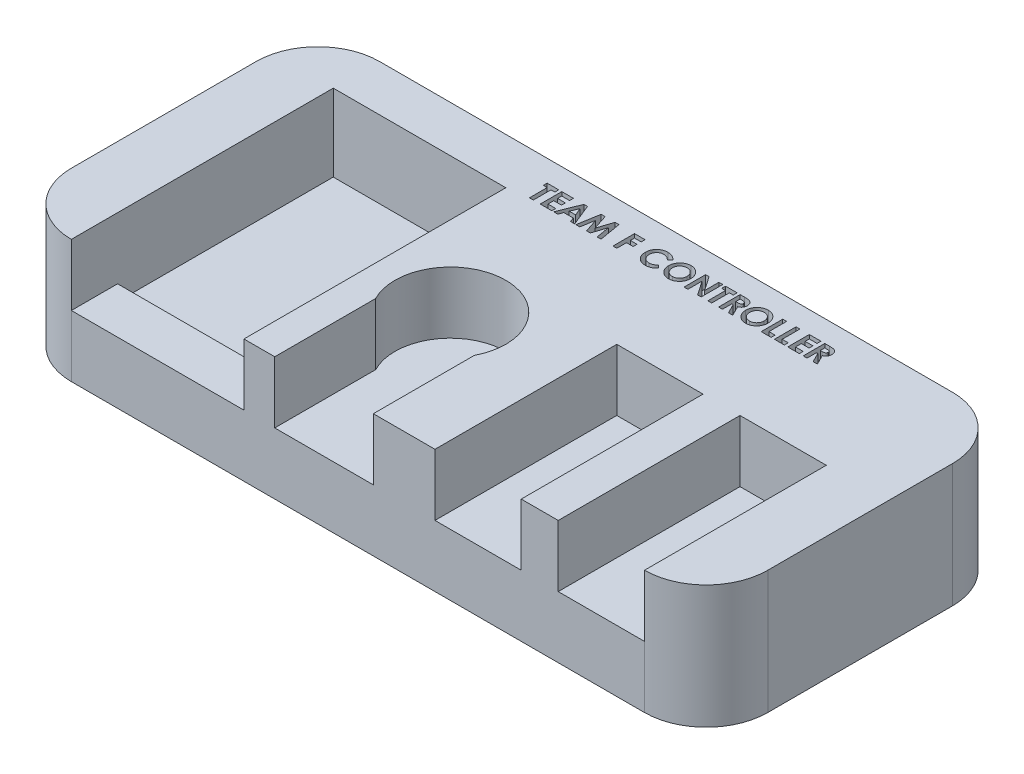
from build123d import *

# Parameters (mm, degrees)
SKETCH1_W           = 113
SKETCH1_H           = 50
BOSS_EXTRUDE1_DEPTH = 20
SKETCH2_W           = 28
SKETCH2_H           = 35
CUT_EXTRUDE2_DEPTH  = 12.5
CUT_EXTRUDE3_DEPTH  = 10
SKETCH4_W           = 14
SKETCH4_H           = 22
CUT_EXTRUDE4_DEPTH  = 10
CUT_EXTRUDE5_DEPTH  = 2
SKETCH6_W           = 14
SKETCH6_H           = 10
SKETCH6_W_2         = 16
SKETCH6_W_3         = 28
CUT_EXTRUDE6_DEPTH  = 10
FILLET1_R           = 10


with BuildPart() as part:
    # Sketch1 → Boss-Extrude1 (new body)
    with BuildSketch(Plane(origin=(0, 0, 0), x_dir=(1, 0, 0), z_dir=(0, 1, 0))):
        Rectangle(SKETCH1_W, SKETCH1_H)
    extrude(amount=BOSS_EXTRUDE1_DEPTH)

    # Sketch2 → Cut-Extrude2 (cut)
    with BuildSketch(Plane(origin=(0, 20, 0), x_dir=(1, 0, 0), z_dir=(0, 1, 0))):
        with Locations((-32.5, 0)):
            Rectangle(SKETCH2_W, SKETCH2_H)
    extrude(amount=-CUT_EXTRUDE2_DEPTH, mode=Mode.SUBTRACT)

    # Sketch3 → Cut-Extrude3 (cut)
    with BuildSketch(Plane(origin=(0, 20, 0), x_dir=(1, 0, 0), z_dir=(0, 1, 0))):
        with BuildLine():
            Line((-13.5, -8.623105626), (-13.5, -17.5))
            Line((-13.5, -17.5), (2.5, -17.5))
            Line((2.5, -17.5), (2.5, -8.623105626))
            ThreePointArc((2.5, -8.623105626), (-5.5, 4.5), (-13.5, -8.623105626))
        make_face()
    extrude(amount=-CUT_EXTRUDE3_DEPTH, mode=Mode.SUBTRACT)

    # Sketch4 → Cut-Extrude4 (cut)
    with BuildSketch(Plane(origin=(0, 20, 0), x_dir=(1, 0, 0), z_dir=(0, 1, 0))):
        with Locations((19.5, -6.5)):
            Rectangle(SKETCH4_W, SKETCH4_H)
        with Locations((39.5, -6.5)):
            Rectangle(SKETCH4_W, SKETCH4_H)
    extrude(amount=-CUT_EXTRUDE4_DEPTH, mode=Mode.SUBTRACT)

    # Sketch5 → Cut-Extrude5 (cut)
    # profile 1 of 15: a face of its own
    with BuildSketch(Plane(origin=(0, 20, 0), x_dir=(1, 0, 0), z_dir=(0, 1, 0))):
        Polygon((-15.798076923, 21.5), (-13.913461538, 21.5), (-13.913461538, 20.871794872), (-14.541666667, 20.871794872), (-14.541666667, 18), (-15.169871795, 18), (-15.169871795, 20.871794872), (-15.798076923, 20.871794872), align=None)
    # profile 2 of 15: a face of its own
    with BuildSketch(Plane(origin=(0, 20, 0), x_dir=(1, 0, 0), z_dir=(0, 1, 0))):
        Polygon((-13.419871795, 21.5), (-11.53525641, 21.5), (-11.53525641, 20.871794872), (-12.791666667, 20.871794872), (-12.791666667, 20.198717949), (-11.53525641, 20.198717949), (-11.53525641, 19.570512821), (-12.791666667, 19.570512821), (-12.791666667, 18.628205128), (-11.53525641, 18.628205128), (-11.53525641, 18), (-13.419871795, 18), align=None)
    # profile 3 of 15: a face of its own
    with BuildSketch(Plane(origin=(0, 20, 0), x_dir=(1, 0, 0), z_dir=(0, 1, 0))):
        Polygon((-9.829427083, 21.5), (-9.246794872, 21.5), (-7.833333333, 18), (-8.504306891, 18), (-8.776342147, 18.717948718), (-10.301282051, 18.717948718), (-10.573317308, 18), (-11.243589744, 18), align=None)
        Polygon((-9.538461538, 20.561197917), (-10.062900641, 19.346153846), (-9.014022436, 19.346153846), align=None, mode=Mode.SUBTRACT)
    # profile 4 of 15: a face of its own
    with BuildSketch(Plane(origin=(0, 20, 0), x_dir=(1, 0, 0), z_dir=(0, 1, 0))):
        Polygon((-7.040364583, 21.5), (-6.388321314, 21.5), (-5.58974359, 19.05869391), (-4.785556891, 21.5), (-4.139823718, 21.5), (-3.548076923, 18), (-4.183994391, 18), (-4.557692308, 20.210637019), (-5.285456731, 18), (-5.898237179, 18), (-6.621794872, 20.210637019), (-6.994791667, 18), (-7.631410256, 18), align=None)
    # profile 5 of 15: a face of its own
    with BuildSketch(Plane(origin=(0, 20, 0), x_dir=(1, 0, 0), z_dir=(0, 1, 0))):
        Polygon((-1.618589744, 21.5), (0.086538462, 21.5), (0.086538462, 20.871794872), (-0.990384615, 20.871794872), (-0.990384615, 20.198717949), (0.086538462, 20.198717949), (0.086538462, 19.570512821), (-0.990384615, 19.570512821), (-0.990384615, 18), (-1.618589744, 18), align=None)
    # profile 6 of 15: a face of its own
    with BuildSketch(Plane(origin=(0, 20, 0), x_dir=(1, 0, 0), z_dir=(0, 1, 0))):
        with BuildLine():
            Line((5.201923077, 20.892828526), (4.741286058, 20.452524038))
            add(Edge.make_bspline(
                [(4.741286058, 20.452524038), (4.702211073, 20.492927638), (4.625885386, 20.571848526), (4.502895981, 20.676332827), (4.374991478, 20.763406355), (4.244660004, 20.836739125), (4.109557273, 20.892220593), (3.97124544, 20.932650872), (3.828841345, 20.957299686), (3.732467731, 20.960119946), (3.683994391, 20.961538462)],
                knots=[0, 0, 0, 0, 1.115251505, 2.178435587, 3.19620269, 4.182487026, 5.141301733, 6.088180966, 7.038406374, 8, 8, 8, 8], degree=3))
            add(Edge.make_bspline(
                [(3.683994391, 20.961538462), (3.643513262, 20.960417785), (3.563628213, 20.958206253), (3.446336028, 20.941993543), (3.334139992, 20.914423124), (3.226656038, 20.876425979), (3.124200445, 20.82725969), (3.0265584, 20.766962311), (2.933970636, 20.696078413), (2.847660184, 20.614974752), (2.768706416, 20.526362907), (2.698945735, 20.431814281), (2.640509974, 20.331545478), (2.592552695, 20.226571947), (2.555195829, 20.116407818), (2.528518333, 20.00112726), (2.513088782, 19.88059298), (2.510785819, 19.798654675), (2.509615385, 19.757011218)],
                knots=[0, 0, 0, 0, 1.035432265, 2.043311493, 3.022114605, 3.98653278, 4.95457646, 5.923598177, 6.917315552, 7.932509744, 8.948865224, 9.949768934, 10.933144597, 11.912367597, 12.897413939, 13.903909035, 14.934704909, 16, 16, 16, 16], degree=3))
            add(Edge.make_bspline(
                [(2.509615385, 19.757011218), (2.50995269, 19.727782926), (2.510617527, 19.670173362), (2.517895338, 19.584952828), (2.52961433, 19.502268764), (2.546574616, 19.422246412), (2.567783619, 19.344816425), (2.59266661, 19.26931082), (2.623881955, 19.196772912), (2.65853146, 19.126360221), (2.698828434, 19.059994047), (2.742276006, 18.996708391), (2.789387805, 18.936813475), (2.840468975, 18.88055415), (2.896238422, 18.828809624), (2.955254711, 18.780023877), (3.018513366, 18.735418182), (3.084700343, 18.69387311), (3.154387415, 18.657782552), (3.22568381, 18.625091479), (3.299670525, 18.598541467), (3.375446727, 18.577139735), (3.452741618, 18.558940759), (3.532311215, 18.54773509), (3.613465749, 18.539249168), (3.668312593, 18.538725212), (3.695913462, 18.538461538)],
                knots=[0, 0, 0, 0, 1.103660481, 2.175337485, 3.227646561, 4.255952547, 5.262355991, 6.258840057, 7.255597736, 8.242457506, 9.22035537, 10.185017736, 11.140346927, 12.096287581, 13.051739095, 14.01125915, 14.986044842, 15.97314143, 16.960198552, 17.947847494, 18.933482797, 19.925264591, 20.920966487, 21.929612487, 22.958107872, 24, 24, 24, 24], degree=3))
            add(Edge.make_bspline(
                [(3.695913462, 18.538461538), (3.742729278, 18.5398157), (3.834710185, 18.542476276), (3.969705391, 18.563281603), (4.098342373, 18.597505189), (4.201122706, 18.637921255), (4.281648382, 18.677832645), (4.342951389, 18.714748715), (4.406343476, 18.756043392), (4.470771755, 18.803275183), (4.536960916, 18.855877287), (4.603742568, 18.915001788), (4.672826333, 18.978701801), (4.718082423, 19.024165752), (4.741286058, 19.047475962)],
                knots=[0, 0, 0, 0, 1.404581149, 2.759636711, 4.088442092, 5.392261763, 6.066678138, 6.783632037, 7.538459478, 8.336747902, 9.180226004, 10.074962426, 11.012997595, 12, 12, 12, 12], degree=3))
            Line((4.741286058, 19.047475962), (5.187900641, 18.578425481))
            add(Edge.make_bspline(
                [(5.187900641, 18.578425481), (5.15650604, 18.548114979), (5.095230492, 18.488955361), (5.002798029, 18.404954225), (4.910481897, 18.329469865), (4.820512259, 18.259762532), (4.731415321, 18.197862968), (4.64320053, 18.143709355), (4.556866516, 18.095932068), (4.470620526, 18.055336849), (4.383925893, 18.020867291), (4.294727304, 17.991191265), (4.20275207, 17.966086414), (4.107438449, 17.945830096), (4.009675467, 17.929587264), (3.908548194, 17.918623446), (3.804697825, 17.911252837), (3.734254512, 17.910590526), (3.698717949, 17.91025641)],
                knots=[0, 0, 0, 0, 1.244526981, 2.429050516, 3.560637417, 4.644440555, 5.67424972, 6.652764056, 7.595344123, 8.486817594, 9.369275933, 10.254498637, 11.166417451, 12.086725134, 13.032340136, 13.991389299, 14.986715468, 16, 16, 16, 16], degree=3))
            add(Edge.make_bspline(
                [(3.698717949, 17.91025641), (3.633441685, 17.911920432), (3.505714181, 17.915176461), (3.318532854, 17.93930143), (3.140715618, 17.979746515), (2.971829878, 18.036947022), (2.811929333, 18.110017988), (2.661054893, 18.199599561), (2.519449733, 18.305453737), (2.388257744, 18.426339803), (2.269588346, 18.559848314), (2.164698341, 18.703199828), (2.077933325, 18.857098866), (2.005890462, 19.019271846), (1.949553891, 19.190458828), (1.909902496, 19.370844982), (1.88544977, 19.560256136), (1.882774607, 19.689628321), (1.881410256, 19.755608974)],
                knots=[0, 0, 0, 0, 1.078019885, 2.10938526, 3.111377082, 4.085535484, 5.04941344, 6.010039228, 6.978205633, 7.964457913, 8.951525778, 9.924444315, 10.892603023, 11.863865945, 12.85144698, 13.863884204, 14.910567087, 16, 16, 16, 16], degree=3))
            add(Edge.make_bspline(
                [(1.881410256, 19.755608974), (1.881986765, 19.798640994), (1.883129264, 19.883919938), (1.895137031, 20.009542733), (1.911876557, 20.132002487), (1.938432293, 20.250027663), (1.970442613, 20.365208277), (2.010251652, 20.476292451), (2.057795829, 20.583599451), (2.111542683, 20.687308917), (2.172345962, 20.78674144), (2.240269899, 20.881042737), (2.313565868, 20.970940799), (2.393995051, 21.055242959), (2.480388707, 21.134689407), (2.573136894, 21.208849608), (2.671681776, 21.278787103), (2.776290079, 21.342698373), (2.884929543, 21.400509514), (2.996229936, 21.451501409), (3.109917809, 21.494118891), (3.225512477, 21.529468521), (3.343502326, 21.555854519), (3.463045176, 21.575827869), (3.585158193, 21.586993099), (3.667146504, 21.588820919), (3.708533654, 21.58974359)],
                knots=[0, 0, 0, 0, 1.071919942, 2.124283339, 3.142214191, 4.149696895, 5.136002878, 6.119640489, 7.086990633, 8.058538607, 9.028339693, 9.988281803, 10.952401235, 11.916291999, 12.888973767, 13.874849856, 14.873389453, 15.898127285, 16.927174885, 17.938320013, 18.946391617, 19.950418109, 20.947802303, 21.956882652, 22.968648068, 24, 24, 24, 24], degree=3))
            add(Edge.make_bspline(
                [(3.708533654, 21.58974359), (3.743841136, 21.589214692), (3.814089001, 21.588162395), (3.91869986, 21.579390354), (4.02247409, 21.565613953), (4.125040148, 21.544828298), (4.227131691, 21.520153099), (4.327407122, 21.487844329), (4.42744834, 21.451830117), (4.525686347, 21.408782479), (4.622258268, 21.361792095), (4.714901755, 21.308479797), (4.805172283, 21.252126365), (4.891069512, 21.189396556), (4.97420248, 21.122565697), (5.05413648, 21.051321984), (5.130170043, 20.974477576), (5.177884485, 20.920182466), (5.201923077, 20.892828526)],
                knots=[0, 0, 0, 0, 0.996412454, 1.982464992, 2.961075852, 3.949442424, 4.934965278, 5.923860011, 6.921385422, 7.934793307, 8.949617135, 9.951082467, 10.950285876, 11.951772932, 12.951063433, 13.960125323, 14.972308753, 16, 16, 16, 16], degree=3))
        make_face()
    # profile 7 of 15: a face of its own
    with BuildSketch(Plane(origin=(0, 20, 0), x_dir=(1, 0, 0), z_dir=(0, 1, 0))):
        with BuildLine():
            add(Edge.make_bspline(
                [(7.474959936, 21.58974359), (7.535811725, 21.588168028), (7.65594694, 21.585057512), (7.83262249, 21.559128935), (8.002882048, 21.516882035), (8.166648626, 21.458155789), (8.323512169, 21.381359592), (8.474025989, 21.288670665), (8.617650952, 21.178339561), (8.752915304, 21.052940123), (8.877923961, 20.91657371), (8.986244036, 20.769751021), (9.078615421, 20.616276382), (9.155173073, 20.455738551), (9.213485974, 20.287025729), (9.254406549, 20.110998126), (9.280695991, 19.927705822), (9.283719681, 19.802908746), (9.28525641, 19.739483173)],
                knots=[0, 0, 0, 0, 1.014329547, 2.002516266, 2.970391464, 3.935626869, 4.897733899, 5.877609409, 6.878433252, 7.912639331, 8.949961323, 9.958554974, 10.949718813, 11.932905612, 12.9188844, 13.919928257, 14.942845884, 16, 16, 16, 16], degree=3))
            add(Edge.make_bspline(
                [(9.28525641, 19.739483173), (9.28361986, 19.67677226), (9.280394986, 19.553198393), (9.255479799, 19.371595199), (9.213870117, 19.197453219), (9.156546248, 19.030378278), (9.081377063, 18.871179629), (8.99080702, 18.718840812), (8.882446148, 18.574775566), (8.760246793, 18.439061204), (8.625715909, 18.315871298), (8.483226346, 18.207310407), (8.333436033, 18.115320004), (8.176564215, 18.039942227), (8.012274488, 17.98144431), (7.840972669, 17.940169778), (7.662669356, 17.915086412), (7.541414457, 17.911882603), (7.479867788, 17.91025641)],
                knots=[0, 0, 0, 0, 1.051557043, 2.072126891, 3.067553643, 4.050577992, 5.02905126, 6.015227836, 7.017913613, 8.04756643, 9.074058332, 10.072836633, 11.047628519, 12.017157415, 12.98668631, 13.966869689, 14.968021931, 16, 16, 16, 16], degree=3))
            add(Edge.make_bspline(
                [(7.479867788, 17.91025641), (7.415497353, 17.911715185), (7.289018247, 17.914581478), (7.103915508, 17.941838618), (6.92657109, 17.982897391), (6.758474788, 18.044175408), (6.597914685, 18.120778081), (6.446070463, 18.215118866), (6.302993152, 18.327041858), (6.169503466, 18.453680666), (6.048561488, 18.592251298), (5.941806469, 18.738638882), (5.851756242, 18.891725147), (5.778407513, 19.051581739), (5.720582322, 19.217215189), (5.679793219, 19.389634252), (5.655698123, 19.568425405), (5.652341816, 19.68986393), (5.650641026, 19.751402244)],
                knots=[0, 0, 0, 0, 1.067978421, 2.098431617, 3.099715153, 4.085208694, 5.062210972, 6.048429807, 7.046490867, 8.072918869, 9.098532598, 10.095778865, 11.076610158, 12.041847152, 13.011192615, 13.984257998, 14.978533688, 16, 16, 16, 16], degree=3))
            add(Edge.make_bspline(
                [(5.650641026, 19.751402244), (5.651174832, 19.792801999), (5.652235684, 19.875077294), (5.665014773, 19.997005082), (5.683412988, 20.116553003), (5.710623073, 20.233244418), (5.743676373, 20.34790253), (5.786501592, 20.459460075), (5.83524828, 20.569108792), (5.892204196, 20.675553593), (5.955533667, 20.777815097), (6.024631759, 20.87541092), (6.099672217, 20.967160983), (6.180413311, 21.053668232), (6.267133286, 21.134364048), (6.358691431, 21.210390793), (6.45686344, 21.279728925), (6.559500636, 21.34407182), (6.666024374, 21.402255985), (6.776001006, 21.451780605), (6.887164796, 21.495029613), (7.001000742, 21.529163642), (7.11628889, 21.556965452), (7.234260859, 21.575351265), (7.353850841, 21.588130001), (7.434494432, 21.58920445), (7.474959936, 21.58974359)],
                knots=[0, 0, 0, 0, 1.034744296, 2.056386356, 3.06226378, 4.057406941, 5.050368692, 6.043467995, 7.042652155, 8.049140477, 9.059438543, 10.048523776, 11.036952808, 12.020949711, 13.004946614, 13.997082645, 14.994316842, 16.007702937, 17.024872941, 18.026463647, 19.021641123, 20.005082605, 20.995858141, 21.984425357, 22.988620895, 24, 24, 24, 24], degree=3))
        make_face()
        with BuildLine():
            add(Edge.make_bspline(
                [(7.465144231, 20.961538462), (7.424190985, 20.960439594), (7.343365664, 20.958270869), (7.224809639, 20.941748119), (7.110991669, 20.91535941), (7.00254269, 20.877135687), (6.898992676, 20.828486588), (6.800158065, 20.7695821), (6.707407512, 20.698397447), (6.619504278, 20.618754215), (6.54009817, 20.530013352), (6.469940369, 20.434912425), (6.41122959, 20.333610251), (6.362058945, 20.227047904), (6.325044347, 20.114027118), (6.298679958, 19.995433197), (6.282018649, 19.871061798), (6.27991847, 19.786277978), (6.278846154, 19.742988782)],
                knots=[0, 0, 0, 0, 1.033739768, 2.040188636, 3.016340934, 3.979330865, 4.937572243, 5.900995986, 6.878200029, 7.884839167, 8.891893314, 9.879764717, 10.863503415, 11.843163062, 12.837761627, 13.859916423, 14.907309254, 16, 16, 16, 16], degree=3))
            add(Edge.make_bspline(
                [(6.278846154, 19.742988782), (6.280267881, 19.695014616), (6.283054231, 19.600993199), (6.302659329, 19.463837288), (6.336201699, 19.334307144), (6.384636229, 19.213036278), (6.444707753, 19.098678068), (6.519307052, 18.992634136), (6.607225971, 18.894269542), (6.674957994, 18.836840195), (6.709334936, 18.807692308)],
                knots=[0, 0, 0, 0, 1.078454662, 2.113592447, 3.107694534, 4.079536787, 5.043276885, 6.005368276, 6.987637804, 8, 8, 8, 8], degree=3))
            add(Edge.make_bspline(
                [(6.709334936, 18.807692308), (6.737496214, 18.786158968), (6.793184293, 18.743577439), (6.882074591, 18.689000474), (6.973614094, 18.642222571), (7.068493584, 18.604426578), (7.166512678, 18.574696886), (7.267657937, 18.553877671), (7.371786045, 18.540811814), (7.442202352, 18.539250196), (7.477764423, 18.538461538)],
                knots=[0, 0, 0, 0, 1.023928204, 2.024787132, 3.009472467, 3.9914905, 4.972207045, 5.96565515, 6.972602802, 8, 8, 8, 8], degree=3))
            add(Edge.make_bspline(
                [(7.477764423, 18.538461538), (7.518013477, 18.539569723), (7.597204757, 18.541750111), (7.713553798, 18.558069457), (7.825019713, 18.585687682), (7.932294491, 18.623576093), (8.035068801, 18.672836023), (8.132840357, 18.733567544), (8.225780577, 18.805024949), (8.313571824, 18.885714071), (8.393817174, 18.974804512), (8.46382857, 19.070412698), (8.524406058, 19.170432093), (8.572554199, 19.276278322), (8.611031161, 19.386952245), (8.63707824, 19.502944012), (8.6538803, 19.623775463), (8.65598107, 19.706005535), (8.657051282, 19.747896635)],
                knots=[0, 0, 0, 0, 1.026359118, 2.019393844, 2.989460624, 3.950973911, 4.916101784, 5.890408035, 6.881132271, 7.902007068, 8.92769091, 9.933912415, 10.920395702, 11.90457117, 12.894218921, 13.903490204, 14.931958862, 16, 16, 16, 16], degree=3))
            add(Edge.make_bspline(
                [(8.657051282, 19.747896635), (8.655944041, 19.789546849), (8.653764606, 19.871528943), (8.637416537, 19.992049736), (8.609973459, 20.107529435), (8.571971273, 20.218156627), (8.523444494, 20.324039771), (8.463436208, 20.424806517), (8.392156978, 20.520359449), (8.311247291, 20.61004741), (8.223182068, 20.692464901), (8.128635253, 20.763988302), (8.03025237, 20.826139863), (7.925776037, 20.874826886), (7.817343752, 20.913615734), (7.704293854, 20.942180399), (7.586198162, 20.958154796), (7.505855221, 20.960400519), (7.465144231, 20.961538462)],
                knots=[0, 0, 0, 0, 1.055025985, 2.07665775, 3.074803781, 4.057872707, 5.035505728, 6.020516407, 7.023567878, 8.050795229, 9.077271434, 10.074415901, 11.050397877, 12.019801805, 12.988065821, 13.964604439, 14.968634123, 16, 16, 16, 16], degree=3))
        make_face(mode=Mode.SUBTRACT)
    # profile 8 of 15: a face of its own
    with BuildSketch(Plane(origin=(0, 20, 0), x_dir=(1, 0, 0), z_dir=(0, 1, 0))):
        Polygon((9.913461538, 21.5), (10.479266827, 21.5), (12.067307692, 19.196814904), (12.067307692, 21.5), (12.695512821, 21.5), (12.695512821, 18), (12.125500801, 18), (10.541666667, 20.296173878), (10.541666667, 18), (9.913461538, 18), align=None)
    # profile 9 of 15: a face of its own
    with BuildSketch(Plane(origin=(0, 20, 0), x_dir=(1, 0, 0), z_dir=(0, 1, 0))):
        Polygon((13.144230769, 21.5), (15.028846154, 21.5), (15.028846154, 20.871794872), (14.400641026, 20.871794872), (14.400641026, 18), (13.772435897, 18), (13.772435897, 20.871794872), (13.144230769, 20.871794872), align=None)
    # profile 10 of 15: a face of its own
    with BuildSketch(Plane(origin=(0, 20, 0), x_dir=(1, 0, 0), z_dir=(0, 1, 0))):
        with BuildLine():
            Line((15.522435897, 21.5), (16.254407051, 21.5))
            add(Edge.make_bspline(
                [(16.254407051, 21.5), (16.302790122, 21.499828268), (16.395844395, 21.499497979), (16.530023575, 21.494286889), (16.653285604, 21.48703523), (16.765812983, 21.475969006), (16.867557571, 21.46129653), (16.95862134, 21.444000109), (17.039001628, 21.42428713), (17.109376332, 21.399723202), (17.172886023, 21.372015463), (17.232085884, 21.340178764), (17.288281953, 21.304567615), (17.341098619, 21.264244991), (17.390994872, 21.219936286), (17.438064844, 21.171596899), (17.481643393, 21.118816932), (17.521460678, 21.061929887), (17.557750929, 21.00208602), (17.589823899, 20.939203166), (17.615905691, 20.873237592), (17.638951751, 20.805142645), (17.655551081, 20.733944894), (17.667095672, 20.660337461), (17.67554817, 20.58406124), (17.676034149, 20.532242562), (17.676282051, 20.505809295)],
                knots=[0, 0, 0, 0, 1.749336639, 3.364467119, 4.854658419, 6.213483162, 7.451590619, 8.570285859, 9.5643256, 10.440900261, 11.26203566, 12.067320669, 12.869050712, 13.665104639, 14.467235401, 15.27997916, 16.102287765, 16.939272006, 17.78853747, 18.631303466, 19.488103222, 20.351255419, 21.228522269, 22.127379805, 23.044756219, 24, 24, 24, 24], degree=3))
            add(Edge.make_bspline(
                [(17.676282051, 20.505809295), (17.675638089, 20.478219036), (17.674375397, 20.424119568), (17.667573848, 20.344651861), (17.655142754, 20.268622717), (17.636314053, 20.196254741), (17.614672908, 20.126647229), (17.585895735, 20.061084482), (17.553417852, 19.998612986), (17.514844819, 19.940116424), (17.472512799, 19.884295469), (17.423281551, 19.833288831), (17.370340503, 19.784355094), (17.310713645, 19.740559303), (17.247029386, 19.698940145), (17.178022386, 19.661222103), (17.104143007, 19.626457035), (17.052202146, 19.607069631), (17.025641026, 19.597155449)],
                knots=[0, 0, 0, 0, 1.099860209, 2.156625411, 3.176576793, 4.16617041, 5.135385252, 6.078461593, 7.016046972, 7.938469504, 8.868247731, 9.803980173, 10.76021508, 11.73834243, 12.748633912, 13.790971185, 14.870363756, 16, 16, 16, 16], degree=3))
            Line((17.025641026, 19.597155449), (17.833333333, 18))
            Line((17.833333333, 18), (17.135016026, 18))
            Line((17.135016026, 18), (16.363782051, 19.525641026))
            Line((16.363782051, 19.525641026), (16.150641026, 19.525641026))
            Line((16.150641026, 19.525641026), (16.150641026, 18))
            Line((16.150641026, 18), (15.522435897, 18))
            Line((15.522435897, 18), (15.522435897, 21.5))
        make_face()
        with BuildLine():
            Line((16.150641026, 20.153846154), (16.395332532, 20.153846154))
            add(Edge.make_bspline(
                [(16.395332532, 20.153846154), (16.425248103, 20.154183083), (16.482529992, 20.15482823), (16.564908873, 20.15782069), (16.639728544, 20.16503104), (16.707310304, 20.174141047), (16.76799422, 20.184659866), (16.821239012, 20.199733972), (16.867865102, 20.215886258), (16.907319968, 20.23595936), (16.941029298, 20.258786831), (16.970135148, 20.284719405), (16.994209859, 20.314733058), (17.014024574, 20.348012147), (17.029438268, 20.384851019), (17.040689084, 20.424845265), (17.046976626, 20.468450472), (17.047700029, 20.498544002), (17.048076923, 20.514222756)],
                knots=[0, 0, 0, 0, 1.688639943, 3.233382647, 4.650958383, 5.928841754, 7.082724185, 8.122798841, 9.049171256, 9.863274652, 10.613301712, 11.341792392, 12.054588806, 12.776240173, 13.521029143, 14.301969904, 15.115324896, 16, 16, 16, 16], degree=3))
            add(Edge.make_bspline(
                [(17.048076923, 20.514222756), (17.047364371, 20.532771868), (17.045964695, 20.569208159), (17.032075557, 20.621663643), (17.009967051, 20.670214782), (16.979662343, 20.71464221), (16.941497504, 20.75359036), (16.897700341, 20.787923465), (16.847325603, 20.815071516), (16.800682388, 20.832978081), (16.758247964, 20.843691763), (16.719952235, 20.851675505), (16.67560555, 20.857333812), (16.625174431, 20.863335453), (16.568787427, 20.867227214), (16.506137195, 20.870067423), (16.437403668, 20.871229493), (16.389489871, 20.871600986), (16.364483173, 20.871794872)],
                knots=[0, 0, 0, 0, 1.020303359, 2.004196876, 2.966617323, 3.9489082, 4.950758222, 5.960522915, 7.003732012, 8.091992268, 8.70421221, 9.413913587, 10.24622431, 11.166358409, 12.212345909, 13.359657661, 14.621978493, 16, 16, 16, 16], degree=3))
            Line((16.364483173, 20.871794872), (16.150641026, 20.871794872))
            Line((16.150641026, 20.871794872), (16.150641026, 20.153846154))
        make_face(mode=Mode.SUBTRACT)
    # profile 11 of 15: a face of its own
    with BuildSketch(Plane(origin=(0, 20, 0), x_dir=(1, 0, 0), z_dir=(0, 1, 0))):
        with BuildLine():
            add(Edge.make_bspline(
                [(19.994190705, 21.58974359), (20.055042495, 21.588168028), (20.17517771, 21.585057512), (20.351853259, 21.559128935), (20.522112817, 21.516882035), (20.685879395, 21.458155789), (20.842742939, 21.381359592), (20.993256758, 21.288670665), (21.136881721, 21.178339561), (21.272146074, 21.052940123), (21.397154731, 20.91657371), (21.505474805, 20.769751021), (21.597846191, 20.616276382), (21.674403842, 20.455738551), (21.732716743, 20.287025729), (21.773637318, 20.110998126), (21.79992676, 19.927705822), (21.80295045, 19.802908746), (21.804487179, 19.739483173)],
                knots=[0, 0, 0, 0, 1.014329547, 2.002516266, 2.970391464, 3.935626869, 4.897733899, 5.877609409, 6.878433252, 7.912639331, 8.949961323, 9.958554974, 10.949718813, 11.932905612, 12.9188844, 13.919928257, 14.942845884, 16, 16, 16, 16], degree=3))
            add(Edge.make_bspline(
                [(21.804487179, 19.739483173), (21.80285063, 19.67677226), (21.799625755, 19.553198393), (21.774710568, 19.371595199), (21.733100886, 19.197453219), (21.675777017, 19.030378278), (21.600607832, 18.871179629), (21.510037789, 18.718840812), (21.401676917, 18.574775566), (21.279477562, 18.439061204), (21.144946678, 18.315871298), (21.002457115, 18.207310407), (20.852666802, 18.115320004), (20.695794984, 18.039942227), (20.531505257, 17.98144431), (20.360203438, 17.940169778), (20.181900125, 17.915086412), (20.060645226, 17.911882603), (19.999098558, 17.91025641)],
                knots=[0, 0, 0, 0, 1.051557043, 2.072126891, 3.067553643, 4.050577992, 5.02905126, 6.015227836, 7.017913613, 8.04756643, 9.074058332, 10.072836633, 11.047628519, 12.017157415, 12.98668631, 13.966869689, 14.968021931, 16, 16, 16, 16], degree=3))
            add(Edge.make_bspline(
                [(19.999098558, 17.91025641), (19.934728122, 17.911715185), (19.808249016, 17.914581478), (19.623146277, 17.941838618), (19.445801859, 17.982897391), (19.277705557, 18.044175408), (19.117145454, 18.120778081), (18.965301232, 18.215118866), (18.822223921, 18.327041858), (18.688734235, 18.453680666), (18.567792257, 18.592251298), (18.461037238, 18.738638882), (18.370987011, 18.891725147), (18.297638282, 19.051581739), (18.239813091, 19.217215189), (18.199023988, 19.389634252), (18.174928892, 19.568425405), (18.171572585, 19.68986393), (18.169871795, 19.751402244)],
                knots=[0, 0, 0, 0, 1.067978421, 2.098431617, 3.099715153, 4.085208694, 5.062210972, 6.048429807, 7.046490867, 8.072918869, 9.098532598, 10.095778865, 11.076610158, 12.041847152, 13.011192615, 13.984257998, 14.978533688, 16, 16, 16, 16], degree=3))
            add(Edge.make_bspline(
                [(18.169871795, 19.751402244), (18.170405601, 19.792801999), (18.171466454, 19.875077294), (18.184245543, 19.997005082), (18.202643757, 20.116553003), (18.229853843, 20.233244418), (18.262907142, 20.34790253), (18.305732361, 20.459460075), (18.354479049, 20.569108792), (18.411434965, 20.675553593), (18.474764436, 20.777815097), (18.543862528, 20.87541092), (18.618902986, 20.967160983), (18.69964408, 21.053668232), (18.786364056, 21.134364048), (18.8779222, 21.210390793), (18.976094209, 21.279728925), (19.078731405, 21.34407182), (19.185255143, 21.402255985), (19.295231775, 21.451780605), (19.406395565, 21.495029613), (19.520231511, 21.529163642), (19.635519659, 21.556965452), (19.753491628, 21.575351265), (19.87308161, 21.588130001), (19.953725202, 21.58920445), (19.994190705, 21.58974359)],
                knots=[0, 0, 0, 0, 1.034744296, 2.056386356, 3.06226378, 4.057406941, 5.050368692, 6.043467995, 7.042652155, 8.049140477, 9.059438543, 10.048523776, 11.036952808, 12.020949711, 13.004946614, 13.997082645, 14.994316842, 16.007702937, 17.024872941, 18.026463647, 19.021641123, 20.005082605, 20.995858141, 21.984425357, 22.988620895, 24, 24, 24, 24], degree=3))
        make_face()
        with BuildLine():
            add(Edge.make_bspline(
                [(19.984375, 20.961538462), (19.943421754, 20.960439594), (19.862596434, 20.958270869), (19.744040409, 20.941748119), (19.630222438, 20.91535941), (19.521773459, 20.877135687), (19.418223445, 20.828486588), (19.319388834, 20.7695821), (19.226638281, 20.698397447), (19.138735047, 20.618754215), (19.05932894, 20.530013352), (18.989171139, 20.434912425), (18.930460359, 20.333610251), (18.881289714, 20.227047904), (18.844275116, 20.114027118), (18.817910727, 19.995433197), (18.801249418, 19.871061798), (18.799149239, 19.786277978), (18.798076923, 19.742988782)],
                knots=[0, 0, 0, 0, 1.033739768, 2.040188636, 3.016340934, 3.979330865, 4.937572243, 5.900995986, 6.878200029, 7.884839167, 8.891893314, 9.879764717, 10.863503415, 11.843163062, 12.837761627, 13.859916423, 14.907309254, 16, 16, 16, 16], degree=3))
            add(Edge.make_bspline(
                [(18.798076923, 19.742988782), (18.79949865, 19.695014616), (18.802285, 19.600993199), (18.821890098, 19.463837288), (18.855432468, 19.334307144), (18.903866998, 19.213036278), (18.963938522, 19.098678068), (19.038537822, 18.992634136), (19.12645674, 18.894269542), (19.194188763, 18.836840195), (19.228565705, 18.807692308)],
                knots=[0, 0, 0, 0, 1.078454662, 2.113592447, 3.107694534, 4.079536787, 5.043276885, 6.005368276, 6.987637804, 8, 8, 8, 8], degree=3))
            add(Edge.make_bspline(
                [(19.228565705, 18.807692308), (19.256726984, 18.786158968), (19.312415062, 18.743577439), (19.40130536, 18.689000474), (19.492844864, 18.642222571), (19.587724353, 18.604426578), (19.685743448, 18.574696886), (19.786888706, 18.553877671), (19.891016814, 18.540811814), (19.961433121, 18.539250196), (19.996995192, 18.538461538)],
                knots=[0, 0, 0, 0, 1.023928204, 2.024787132, 3.009472467, 3.9914905, 4.972207045, 5.96565515, 6.972602802, 8, 8, 8, 8], degree=3))
            add(Edge.make_bspline(
                [(19.996995192, 18.538461538), (20.037244247, 18.539569723), (20.116435526, 18.541750111), (20.232784567, 18.558069457), (20.344250482, 18.585687682), (20.45152526, 18.623576093), (20.55429957, 18.672836023), (20.652071126, 18.733567544), (20.745011347, 18.805024949), (20.832802593, 18.885714071), (20.913047943, 18.974804512), (20.983059339, 19.070412698), (21.043636828, 19.170432093), (21.091784969, 19.276278322), (21.13026193, 19.386952245), (21.156309009, 19.502944012), (21.173111069, 19.623775463), (21.17521184, 19.706005535), (21.176282051, 19.747896635)],
                knots=[0, 0, 0, 0, 1.026359118, 2.019393844, 2.989460624, 3.950973911, 4.916101784, 5.890408035, 6.881132271, 7.902007068, 8.92769091, 9.933912415, 10.920395702, 11.90457117, 12.894218921, 13.903490204, 14.931958862, 16, 16, 16, 16], degree=3))
            add(Edge.make_bspline(
                [(21.176282051, 19.747896635), (21.17517481, 19.789546849), (21.172995375, 19.871528943), (21.156647306, 19.992049736), (21.129204229, 20.107529435), (21.091202042, 20.218156627), (21.042675263, 20.324039771), (20.982666978, 20.424806517), (20.911387747, 20.520359449), (20.83047806, 20.61004741), (20.742412838, 20.692464901), (20.647866022, 20.763988302), (20.549483139, 20.826139863), (20.445006806, 20.874826886), (20.336574521, 20.913615734), (20.223524624, 20.942180399), (20.105428931, 20.958154796), (20.02508599, 20.960400519), (19.984375, 20.961538462)],
                knots=[0, 0, 0, 0, 1.055025985, 2.07665775, 3.074803781, 4.057872707, 5.035505728, 6.020516407, 7.023567878, 8.050795229, 9.077271434, 10.074415901, 11.050397877, 12.019801805, 12.988065821, 13.964604439, 14.968634123, 16, 16, 16, 16], degree=3))
        make_face(mode=Mode.SUBTRACT)
    # profile 12 of 15: a face of its own
    with BuildSketch(Plane(origin=(0, 20, 0), x_dir=(1, 0, 0), z_dir=(0, 1, 0))):
        Polygon((22.432692308, 21.5), (23.060897436, 21.5), (23.060897436, 18.628205128), (24.048076923, 18.628205128), (24.048076923, 18), (22.432692308, 18), align=None)
    # profile 13 of 15: a face of its own
    with BuildSketch(Plane(origin=(0, 20, 0), x_dir=(1, 0, 0), z_dir=(0, 1, 0))):
        Polygon((24.586538462, 21.5), (25.21474359, 21.5), (25.21474359, 18.628205128), (26.201923077, 18.628205128), (26.201923077, 18), (24.586538462, 18), align=None)
    # profile 14 of 15: a face of its own
    with BuildSketch(Plane(origin=(0, 20, 0), x_dir=(1, 0, 0), z_dir=(0, 1, 0))):
        Polygon((26.740384615, 21.5), (28.625, 21.5), (28.625, 20.871794872), (27.368589744, 20.871794872), (27.368589744, 20.198717949), (28.625, 20.198717949), (28.625, 19.570512821), (27.368589744, 19.570512821), (27.368589744, 18.628205128), (28.625, 18.628205128), (28.625, 18), (26.740384615, 18), align=None)
    # profile 15 of 15: a face of its own
    with BuildSketch(Plane(origin=(0, 20, 0), x_dir=(1, 0, 0), z_dir=(0, 1, 0))):
        with BuildLine():
            Line((29.253205128, 21.5), (29.985176282, 21.5))
            add(Edge.make_bspline(
                [(29.985176282, 21.5), (30.033559353, 21.499828268), (30.126613626, 21.499497979), (30.260792805, 21.494286889), (30.384054834, 21.48703523), (30.496582214, 21.475969006), (30.598326802, 21.46129653), (30.689390571, 21.444000109), (30.769770859, 21.42428713), (30.840145563, 21.399723202), (30.903655254, 21.372015463), (30.962855115, 21.340178764), (31.019051184, 21.304567615), (31.07186785, 21.264244991), (31.121764103, 21.219936286), (31.168834075, 21.171596899), (31.212412624, 21.118816932), (31.252229909, 21.061929887), (31.288520159, 21.00208602), (31.320593129, 20.939203166), (31.346674922, 20.873237592), (31.369720982, 20.805142645), (31.386320312, 20.733944894), (31.397864903, 20.660337461), (31.406317401, 20.58406124), (31.406803379, 20.532242562), (31.407051282, 20.505809295)],
                knots=[0, 0, 0, 0, 1.749336639, 3.364467119, 4.854658419, 6.213483162, 7.451590619, 8.570285859, 9.5643256, 10.440900261, 11.26203566, 12.067320669, 12.869050712, 13.665104639, 14.467235401, 15.27997916, 16.102287765, 16.939272006, 17.78853747, 18.631303466, 19.488103222, 20.351255419, 21.228522269, 22.127379805, 23.044756219, 24, 24, 24, 24], degree=3))
            add(Edge.make_bspline(
                [(31.407051282, 20.505809295), (31.40640732, 20.478219036), (31.405144627, 20.424119568), (31.398343079, 20.344651861), (31.385911985, 20.268622717), (31.367083284, 20.196254741), (31.345442138, 20.126647229), (31.316664966, 20.061084482), (31.284187083, 19.998612986), (31.245614049, 19.940116424), (31.20328203, 19.884295469), (31.154050782, 19.833288831), (31.101109733, 19.784355094), (31.041482876, 19.740559303), (30.977798617, 19.698940145), (30.908791616, 19.661222103), (30.834912238, 19.626457035), (30.782971377, 19.607069631), (30.756410256, 19.597155449)],
                knots=[0, 0, 0, 0, 1.099860209, 2.156625411, 3.176576793, 4.16617041, 5.135385252, 6.078461593, 7.016046972, 7.938469504, 8.868247731, 9.803980173, 10.76021508, 11.73834243, 12.748633912, 13.790971185, 14.870363756, 16, 16, 16, 16], degree=3))
            Line((30.756410256, 19.597155449), (31.564102564, 18))
            Line((31.564102564, 18), (30.865785256, 18))
            Line((30.865785256, 18), (30.094551282, 19.525641026))
            Line((30.094551282, 19.525641026), (29.881410256, 19.525641026))
            Line((29.881410256, 19.525641026), (29.881410256, 18))
            Line((29.881410256, 18), (29.253205128, 18))
            Line((29.253205128, 18), (29.253205128, 21.5))
        make_face()
        with BuildLine():
            Line((29.881410256, 20.153846154), (30.126101763, 20.153846154))
            add(Edge.make_bspline(
                [(30.126101763, 20.153846154), (30.156017333, 20.154183083), (30.213299223, 20.15482823), (30.295678104, 20.15782069), (30.370497774, 20.16503104), (30.438079535, 20.174141047), (30.498763451, 20.184659866), (30.552008243, 20.199733972), (30.598634332, 20.215886258), (30.638089198, 20.23595936), (30.671798529, 20.258786831), (30.700904379, 20.284719405), (30.72497909, 20.314733058), (30.744793805, 20.348012147), (30.760207499, 20.384851019), (30.771458315, 20.424845265), (30.777745857, 20.468450472), (30.77846926, 20.498544002), (30.778846154, 20.514222756)],
                knots=[0, 0, 0, 0, 1.688639943, 3.233382647, 4.650958383, 5.928841754, 7.082724185, 8.122798841, 9.049171256, 9.863274652, 10.613301712, 11.341792392, 12.054588806, 12.776240173, 13.521029143, 14.301969904, 15.115324896, 16, 16, 16, 16], degree=3))
            add(Edge.make_bspline(
                [(30.778846154, 20.514222756), (30.778133602, 20.532771868), (30.776733926, 20.569208159), (30.762844788, 20.621663643), (30.740736281, 20.670214782), (30.710431574, 20.71464221), (30.672266735, 20.75359036), (30.628469571, 20.787923465), (30.578094834, 20.815071516), (30.531451618, 20.832978081), (30.489017194, 20.843691763), (30.450721466, 20.851675505), (30.406374781, 20.857333812), (30.355943661, 20.863335453), (30.299556657, 20.867227214), (30.236906426, 20.870067423), (30.168172898, 20.871229493), (30.120259101, 20.871600986), (30.095252404, 20.871794872)],
                knots=[0, 0, 0, 0, 1.020303359, 2.004196876, 2.966617323, 3.9489082, 4.950758222, 5.960522915, 7.003732012, 8.091992268, 8.70421221, 9.413913587, 10.24622431, 11.166358409, 12.212345909, 13.359657661, 14.621978493, 16, 16, 16, 16], degree=3))
            Line((30.095252404, 20.871794872), (29.881410256, 20.871794872))
            Line((29.881410256, 20.871794872), (29.881410256, 20.153846154))
        make_face(mode=Mode.SUBTRACT)
    extrude(amount=-CUT_EXTRUDE5_DEPTH, mode=Mode.SUBTRACT)

    # Sketch6 → Cut-Extrude6 (cut)
    with BuildSketch(Plane(origin=(0, 0, 17.5), x_dir=(-1, 0, 0), z_dir=(0, 0, -1))):
        with Locations((-39.5, 15)):
            Rectangle(SKETCH6_W, SKETCH6_H)
        with Locations((-19.5, 15)):
            Rectangle(SKETCH6_W, SKETCH6_H)
        with Locations((5.5, 15)):
            Rectangle(SKETCH6_W_2, SKETCH6_H)
        with Locations((32.5, 15)):
            Rectangle(SKETCH6_W_3, SKETCH6_H)
    extrude(amount=-CUT_EXTRUDE6_DEPTH, mode=Mode.SUBTRACT)

    # Fillet1
    fillet1_edges = [part.edges().sort_by_distance(p)[0] for p in [
        (-56.5, 10, 25),
        (56.5, 10, 25),
        (56.5, 10, -25),
        (-56.5, 10, -25),
    ]]
    fillet(fillet1_edges, radius=FILLET1_R)


solid = part.part
